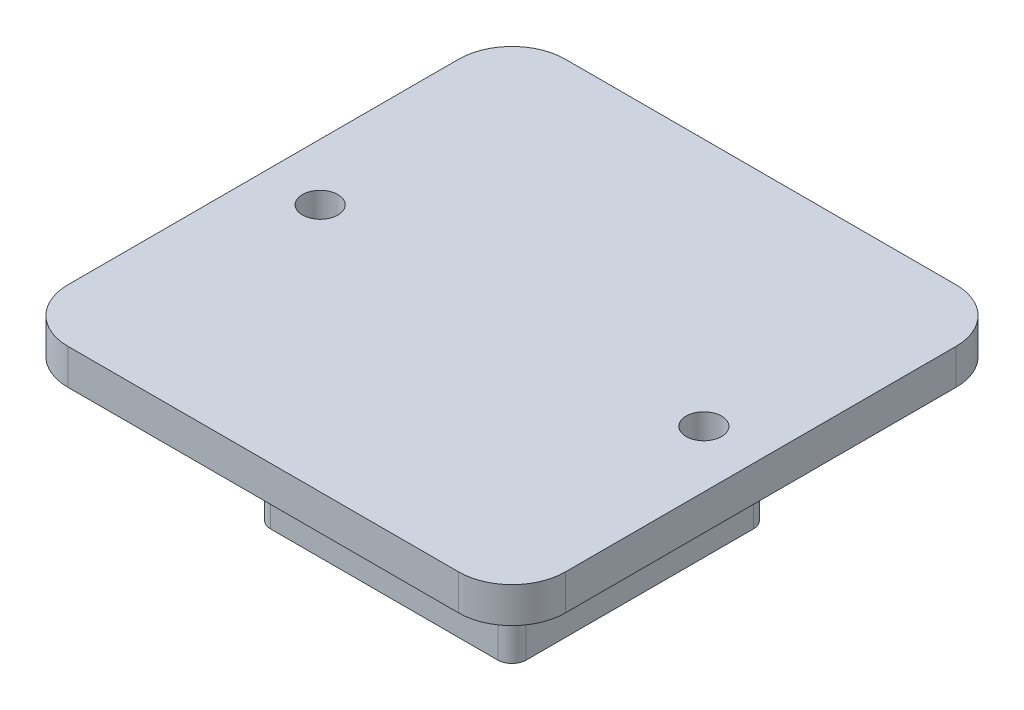
from build123d import *

# Parameters (mm, degrees)
SKETCH1_W           = 36
SKETCH1_H           = 36
SKETCH1_W_2         = 30.02
SKETCH1_H_2         = 30.02
BOSS_EXTRUDE1_DEPTH = 20
SKETCH2_W           = 70
SKETCH2_H           = 70
BOSS_EXTRUDE2_DEPTH = 5
FILLET1_R           = 7.5
SKETCH3_R           = 2.5
CUT_EXTRUDE1_DEPTH  = 56.452682532
FILLET2_R           = 2
FILLET3_R           = 5


with BuildPart() as part:
    # Sketch1 → Boss-Extrude1 (new body)
    with BuildSketch(Plane(origin=(0, 0, 0), x_dir=(1, 0, 0), z_dir=(0, 1, 0))):
        Rectangle(SKETCH1_W, SKETCH1_H)
        Rectangle(SKETCH1_W_2, SKETCH1_H_2, mode=Mode.SUBTRACT)
    extrude(amount=BOSS_EXTRUDE1_DEPTH)

    # Sketch2 → Boss-Extrude2 (add)
    with BuildSketch(Plane(origin=(0, 20, 0), x_dir=(1, 0, 0), z_dir=(0, 1, 0))):
        Rectangle(SKETCH2_W, SKETCH2_H)
    extrude(amount=BOSS_EXTRUDE2_DEPTH)

    # Fillet1
    fillet1_edges = [part.edges().sort_by_distance(p)[0] for p in [
        (35, 22.5, 35),
        (35, 22.5, -35),
        (-35, 22.5, -35),
        (-35, 22.5, 35),
    ]]
    fillet(fillet1_edges, radius=FILLET1_R)

    # Sketch3 → Cut-Extrude1 (cut, through all)
    with BuildSketch(Plane(origin=(0, 25, 0), x_dir=(1, 0, 0), z_dir=(0, 1, 0))):
        with Locations(Location((-27, 0, 0), (0, 0, 270))):
            Circle(SKETCH3_R)
        with Locations(Location((27, 0, 0), (0, 0, 270))):
            Circle(SKETCH3_R)
    extrude(amount=-CUT_EXTRUDE1_DEPTH, mode=Mode.SUBTRACT)

    # Fillet2
    fillet2_edges = [part.edges().sort_by_distance(p)[0] for p in [
        (18, 10, 18),
        (-18, 10, 18),
        (-18, 10, -18),
        (18, 10, -18),
    ]]
    fillet(fillet2_edges, radius=FILLET2_R)

    # Fillet3
    fillet3_edges = [part.edges().sort_by_distance(p)[0] for p in [
        (0, 20, -18),
        (18, 20, 0),
        (0, 20, 18),
        (-18, 20, 0),
        (17.414213562, 20, -17.414213562),
        (17.414213562, 20, 17.414213562),
        (-17.414213562, 20, -17.414213562),
        (-17.414213562, 20, 17.414213562),
    ]]
    fillet(fillet3_edges, radius=FILLET3_R)


solid = part.part
